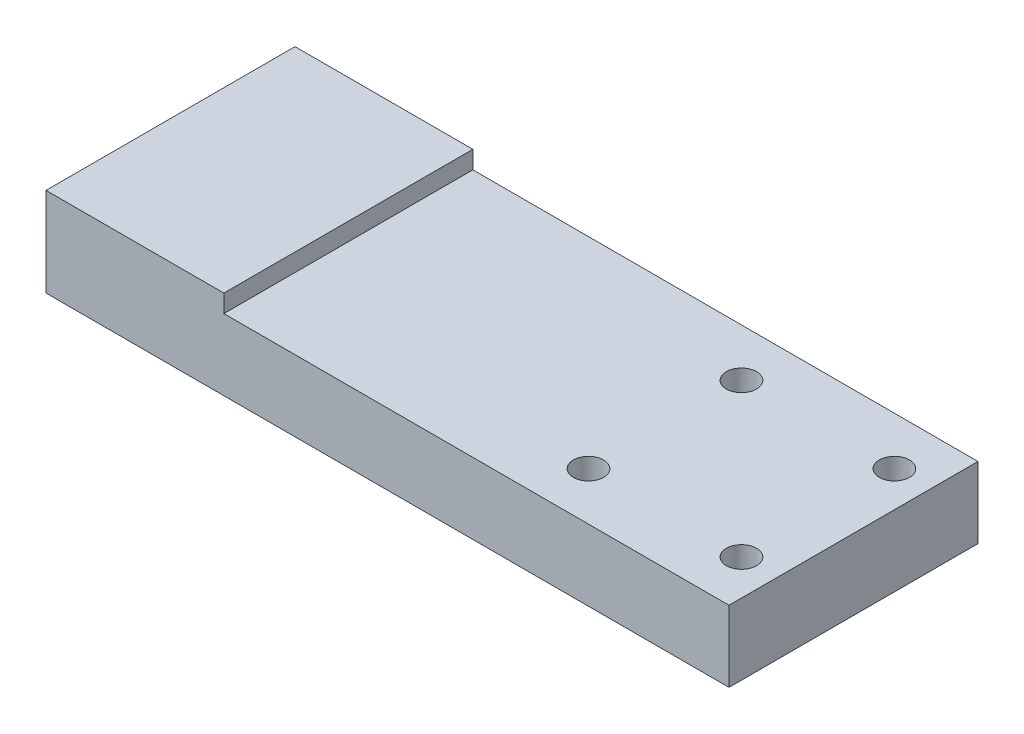
from build123d import *

# Parameters (mm, degrees)
SKETCH_1_W                  = 192
SKETCH_1_H                  = 70
EXTRUDE_1_DEPTH             = 25
CUT_EXTRUDE_1_REACH         = 107.195
SKETCH_2_R                  = 4.25
PATTERN_LINEAR_1_COUNT      = 2
PATTERN_LINEAR_1_PITCH      = 43
PATTERN_LINEAR_1_COUNT_DIR2 = 2
PATTERN_LINEAR_1_PITCH_DIR2 = 43
SKETCH_3_W                  = 142
SKETCH_3_H                  = 70
CUT_EXTRUDE_2_DEPTH         = 5


with BuildPart() as part:
    # 草图1 → 凸台-拉伸1 (new body)
    with BuildSketch(Plane(origin=(0, 0, 0), x_dir=(1, 0, 0), z_dir=(0, 1, 0))):
        Rectangle(SKETCH_1_W, SKETCH_1_H)
    extrude(amount=EXTRUDE_1_DEPTH)

    # 草图2 → 切除-拉伸1 (cut, up to next)
    with BuildSketch(Plane.XZ, mode=Mode.PRIVATE) as cut_extrude_1_sk1:
        with Locations(Location((86, 21.5, 0), (0, 0, 270))):
            Circle(SKETCH_2_R)
    cut_extrude_1_tool1 = extrude(cut_extrude_1_sk1.sketch, amount=-CUT_EXTRUDE_1_REACH, mode=Mode.PRIVATE) & part.part
    cut_extrude_1 = cut_extrude_1_tool1.solids().sort_by_distance((86, 0, 21.5))[0]
    add(cut_extrude_1, mode=Mode.SUBTRACT)

    # 阵列(线性)1: Cut-Extrude 1 2 × 2
    with Locations(*[(-i * PATTERN_LINEAR_1_PITCH, 0, -j * PATTERN_LINEAR_1_PITCH_DIR2) for i in range(PATTERN_LINEAR_1_COUNT) for j in range(PATTERN_LINEAR_1_COUNT_DIR2) if (i, j) != (0, 0)]):
        add(cut_extrude_1, mode=Mode.SUBTRACT)

    # 草图3 → 切除-拉伸2 (cut)
    with BuildSketch(Plane(origin=(0, 25, 0), x_dir=(1, 0, 0), z_dir=(0, 1, 0))):
        with Locations((25, 0)):
            Rectangle(SKETCH_3_W, SKETCH_3_H)
    extrude(amount=-CUT_EXTRUDE_2_DEPTH, mode=Mode.SUBTRACT)


solid = part.part
